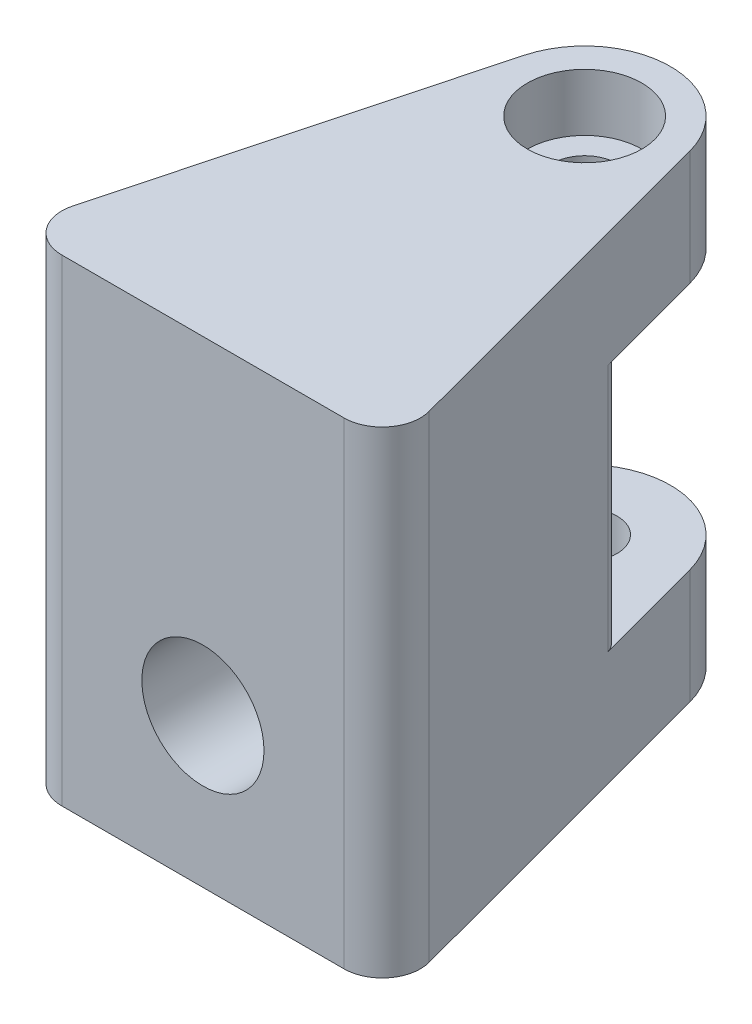
from build123d import *

# Parameters (mm, degrees)
SALIENTE_EXTRUIR1_DEPTH = 25
CROQUIS2_R              = 3.2
CORTAR_EXTRUIR1_DEPTH   = 12
REDONDEO1_R             = 2
CROQUIS3_R              = 1.7
CORTAR_EXTRUIR2_DEPTH   = 34.365826516
CORTAR_EXTRUIR3_START   = 6
CROQUIS4_R              = 6
CORTAR_EXTRUIR3_DEPTH   = 13
CORTAR_EXTRUIR5_DEPTH   = 2.4
CROQUIS7_R              = 3
CORTAR_EXTRUIR6_DEPTH   = 3
REDONDEO2_R             = 1


with BuildPart() as part:
    # Croquis1 → Saliente-Extruir1 (new body)
    with BuildSketch(Plane(origin=(0, 0, 0), x_dir=(1, 0, 0), z_dir=(0, 1, 0))):
        with BuildLine():
            Line((-4.3475753, 1.16128765), (-10, -20))
            Line((-10, -20), (10, -20))
            Line((10, -20), (4.3475753, 1.16128765))
            ThreePointArc((4.3475753, 1.16128765), (0, 4.5), (-4.3475753, 1.16128765))
        make_face()
    extrude(amount=SALIENTE_EXTRUIR1_DEPTH)

    # Croquis2 → Cortar-Extruir1 (cut)
    with BuildSketch(Plane.XY.offset(20)):
        with Locations((0, 7.8)):
            Circle(CROQUIS2_R)
    extrude(amount=-CORTAR_EXTRUIR1_DEPTH, mode=Mode.SUBTRACT)

    # Redondeo1
    redondeo1_edges = [part.edges().sort_by_distance(p)[0] for p in [
        (10, 12.5, 20),
        (-10, 12.5, 20),
    ]]
    fillet(redondeo1_edges, radius=REDONDEO1_R)

    # Croquis3 → Cortar-Extruir2 (cut, through all)
    with BuildSketch(Plane(origin=(0, 25, 0), x_dir=(1, 0, 0), z_dir=(0, 1, 0))):
        with Locations(Location((0, 0, 0), (0, 0, 270))):
            Circle(CROQUIS3_R)
    extrude(amount=-CORTAR_EXTRUIR2_DEPTH, mode=Mode.SUBTRACT)

    # Croquis4 → Cortar-Extruir3 (cut)
    with BuildSketch(Plane(origin=(0, 0, 0), x_dir=(1, 0, 0), z_dir=(0, 1, 0)).offset(CORTAR_EXTRUIR3_START)):
        Circle(CROQUIS4_R)
    extrude(amount=CORTAR_EXTRUIR3_DEPTH, mode=Mode.SUBTRACT)

    # Croquis6 → Cortar-Extruir5 (cut)
    with BuildSketch(Plane(origin=(0, 0, 0), x_dir=(1, 0, 0), z_dir=(0, 1, 0))):
        Polygon((0, -3.464101615), (3, -1.732050808), (3, 1.732050808), (0, 3.464101615), (-3, 1.732050808), (-3, -1.732050808), align=None)
    extrude(amount=CORTAR_EXTRUIR5_DEPTH, mode=Mode.SUBTRACT)

    # Croquis7 → Cortar-Extruir6 (cut)
    with BuildSketch(Plane(origin=(0, 25, 0), x_dir=(1, 0, 0), z_dir=(0, 1, 0))):
        with Locations(Location((0, 0, 0), (0, 0, 270))):
            Circle(CROQUIS7_R)
    extrude(amount=-CORTAR_EXTRUIR6_DEPTH, mode=Mode.SUBTRACT)

    # Redondeo2
    redondeo2_edges = [part.edges().sort_by_distance(p)[0] for p in [
        (5.371734742, 12.5, 2.672913367),
        (-5.371734742, 12.5, 2.672913367),
    ]]
    fillet(redondeo2_edges, radius=REDONDEO2_R)


solid = part.part
